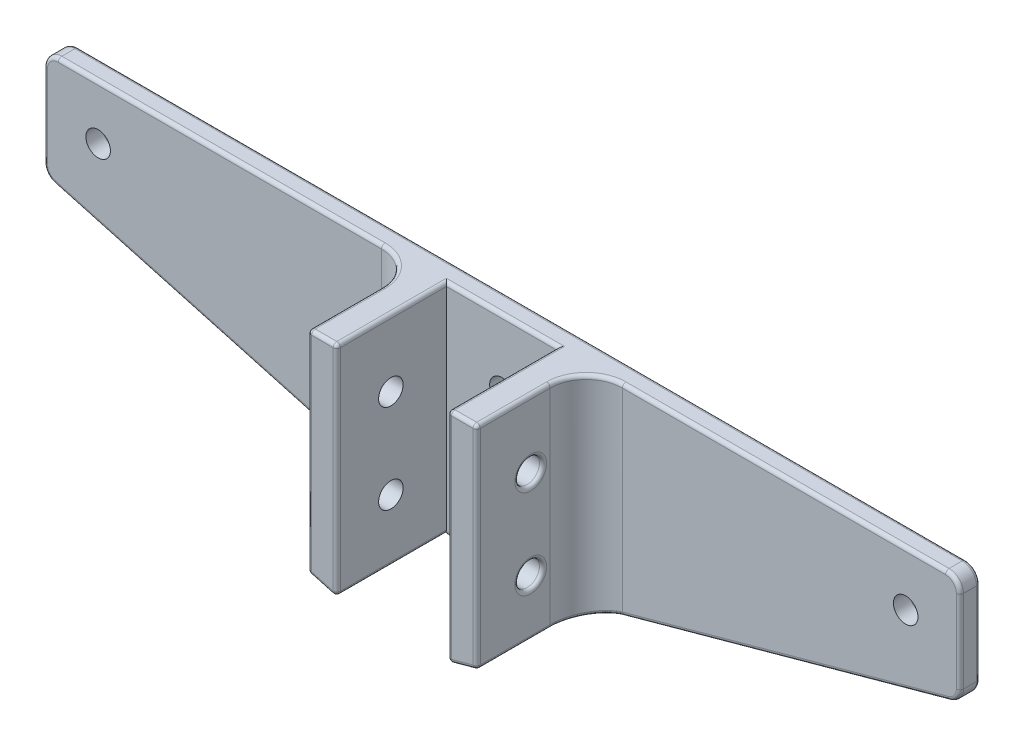
from build123d import *

# Parameters (mm, degrees)
SKETCH1_R               = 1.7
BOSS_EXTRUDE1_DEPTH     = 2.8
BOSS_EXTRUDE2_REACH     = 72.513
SKETCH3_W               = 4
SKETCH3_H               = 15.2
FILLET1_R               = 5
FILLET1_OF_MIRROR1_R    = 5
CUT_EXTRUDE1_DEPTH      = 158.507501235
CUT_EXTRUDE1_DEPTH_BACK = 158.507501235
SKETCH5_R               = 1.7
CUT_EXTRUDE2_DEPTH      = 158.507501235
CIRPATTERN1_COUNT       = 2
CIRPATTERN1_ANGLE       = 90
FILLET2_R               = 2
FILLET3_R               = 0.5


with BuildPart() as part:
    # Sketch1 → Boss-Extrude1 (new body)
    with BuildSketch(Plane.XY):
        Polygon((63.526474366, -112.526474366), (-63.526474366, -112.526474366), (-63.526474366, -127.526474366), (-7.4, -143), (7.4, -143), (63.526474366, -127.526474366), align=None)
        with Locations(Location((-56, -120.026474366, 0), (0, 0, 90))):
            Circle(SKETCH1_R, mode=Mode.SUBTRACT)
        with Locations(Location((56, -120.026474366, 0), (0, 0, 180))):
            Circle(SKETCH1_R, mode=Mode.SUBTRACT)
    extrude(amount=BOSS_EXTRUDE1_DEPTH)

    # Boss-Extrude2: up to this face of the body (flat: up to its plane)
    boss_extrude2_end = Plane(part.part.faces().sort_by_distance((0, -143, 1.4))[0])
    # Sketch3 → Boss-Extrude2 (add, up to the picked face)
    with BuildSketch(Plane(origin=(0, -112.526474366, 0), x_dir=(1, 0, 0), z_dir=(0, 1, 0)), mode=Mode.PRIVATE) as boss_extrude2_sk1:
        with Locations((-9.7, -10.4)):
            Rectangle(SKETCH3_W, SKETCH3_H)
    boss_extrude2_tool1 = split(extrude(boss_extrude2_sk1.sketch, amount=-BOSS_EXTRUDE2_REACH, mode=Mode.PRIVATE), bisect_by=boss_extrude2_end, keep=Keep.BOTH, mode=Mode.PRIVATE)
    boss_extrude2 = boss_extrude2_tool1.solids().sort_by(Axis((-9.7, -112.526474, 10.4), (0, -1, 0)))[0]
    add(boss_extrude2)

    # Fillet1
    fillet1_edges = [part.edges().sort_by_distance(p)[0] for p in [
        (-11.7, -127.170502997, 2.8),
    ]]
    fillet(fillet1_edges, radius=FILLET1_R)

    # Mirror1: Boss-Extrude2 across plane
    add(boss_extrude2.mirror(Plane(origin=(0, 0, 0), x_dir=(0, 0, 1), z_dir=(1, 0, 0))))

    # Fillet1 of Mirror1
    fillet1_of_mirror1_edges = [part.edges().sort_by_distance(p)[0] for p in [
        (11.7, -127.170502997, 2.8),
    ]]
    fillet(fillet1_of_mirror1_edges, radius=FILLET1_OF_MIRROR1_R)

    # Sketch4 → Cut-Extrude1 (cut, two sides: drawn at the far end of the back side and taken through both)
    with BuildSketch(Plane(origin=(0, 0, 0), x_dir=(-1, 0, 0), z_dir=(0, 0, -1)).offset(-CUT_EXTRUDE1_DEPTH_BACK)):
        Polygon((-7.4, -143), (-63.526474366, -127.526474366), (-63.526474366, -166.506470189), (63.526474366, -166.506470189), (63.526474366, -127.526474366), (7.4, -143), align=None)
    extrude(amount=CUT_EXTRUDE1_DEPTH + CUT_EXTRUDE1_DEPTH_BACK, mode=Mode.SUBTRACT)

    # Sketch5 → Cut-Extrude2 (cut, symmetric)
    with BuildSketch(Plane(origin=(0, 0, 0), x_dir=(0, 0, -1), z_dir=(1, 0, 0))):
        with Locations(Location((-10.5, -134.189410254, 0), (0, 0, 90))):
            Circle(SKETCH5_R)
        with Locations(Location((-10.5, -121.810589746, 0), (0, 0, 90))):
            Circle(SKETCH5_R)
    cut_extrude2 = extrude(amount=CUT_EXTRUDE2_DEPTH, both=True, mode=Mode.SUBTRACT)

    # CirPattern1: Cut-Extrude2 ×2 about axis
    cirpattern1_axis = Axis((0, -111.002798084, 10.5), (0, -1, 0))
    for i in range(1, CIRPATTERN1_COUNT):
        add(cut_extrude2.rotate(cirpattern1_axis, i * CIRPATTERN1_ANGLE / (CIRPATTERN1_COUNT - 1)), mode=Mode.SUBTRACT)

    # Fillet2
    fillet2_edges = [part.edges().sort_by_distance(p)[0] for p in [
        (-63.526474366, -112.526474366, 1.4),
        (-63.526474366, -127.526474366, 1.4),
        (-7.4, -143, 1.4),
        (7.4, -143, 1.4),
        (63.526474366, -127.526474366, 1.4),
        (63.526474366, -112.526474366, 1.4),
    ]]
    fillet(fillet2_edges, radius=FILLET2_R)

    # Fillet3
    fillet3_edges = [part.edges().sort_by_distance(p)[0] for p in [
        (-11.7, -135.889410254, 10.5),
        (11.7, -135.889410254, 10.5),
        (-11.7, -123.510589746, 10.5),
        (11.7, -123.510589746, 10.5),
        (0, -135.889410254, 0),
        (0, -123.510589746, 0),
        (39.379012314, -134.183695887, 2.8),
        (34.859466473, -135.429690922, 0),
        (-63.526474366, -120.264858003, 0),
        (0, -112.526474366, 0),
        (63.526474366, -120.264858003, 0),
        (0, -143, 0),
        (-34.859466473, -135.429690922, 0),
        (62.940687928, -113.112260803, 0),
        (63.117558984, -127.21503772, 0),
        (-62.940687928, -113.112260803, 0),
        (-63.117558984, -127.21503772, 0),
        (-7.397555555, -142.981935948, 0),
        (7.397555555, -142.981935948, 0),
        (0, -143, 2.8),
        (-7.68045416, -142.922681503, 2.8),
        (-7.397555555, -142.981935948, 2.8),
        (7.397555555, -142.981935948, 2.8),
        (-63.526474366, -120.264858003, 2.8),
        (-39.113237183, -112.526474366, 2.8),
        (-62.940687928, -113.112260803, 2.8),
        (-63.117558984, -127.21503772, 2.8),
        (63.526474366, -120.264858003, 2.8),
        (62.940687928, -113.112260803, 2.8),
        (63.117558984, -127.21503772, 2.8),
        (0, -112.526474366, 2.8),
        (-9.7, -112.526474366, 18),
        (-7.7, -112.526474366, 10.4),
        (-39.379012314, -134.183695887, 2.8),
        (-11.7, -112.526474366, 12.9),
        (-13.164466094, -112.526474366, 4.264466094),
        (-13.196971996, -141.40183094, 4.232256343),
        (7.68045416, -142.922681503, 2.8),
        (7.7, -112.526474366, 10.4),
        (9.7, -112.526474366, 18),
        (11.7, -112.526474366, 12.9),
        (39.113237183, -112.526474366, 2.8),
        (13.164466094, -112.526474366, 4.264466094),
        (13.196971996, -141.40183094, 4.232256343),
        (-56, -121.726474366, 0),
        (7.7, -127.721883635, 18),
        (11.7, -127.170502997, 18),
        (-7.7, -127.721883635, 18),
        (-11.7, -127.170502997, 18),
        (-11.7, -141.814531627, 12.9),
        (-7.7, -142.917292904, 10.4),
        (9.7, -142.365912266, 18),
        (11.7, -141.814531627, 12.9),
        (7.7, -142.917292904, 10.4),
        (-9.7, -142.365912266, 18),
        (57.7, -120.026474366, 0),
    ]]
    fillet(fillet3_edges, radius=FILLET3_R)


solid = part.part
